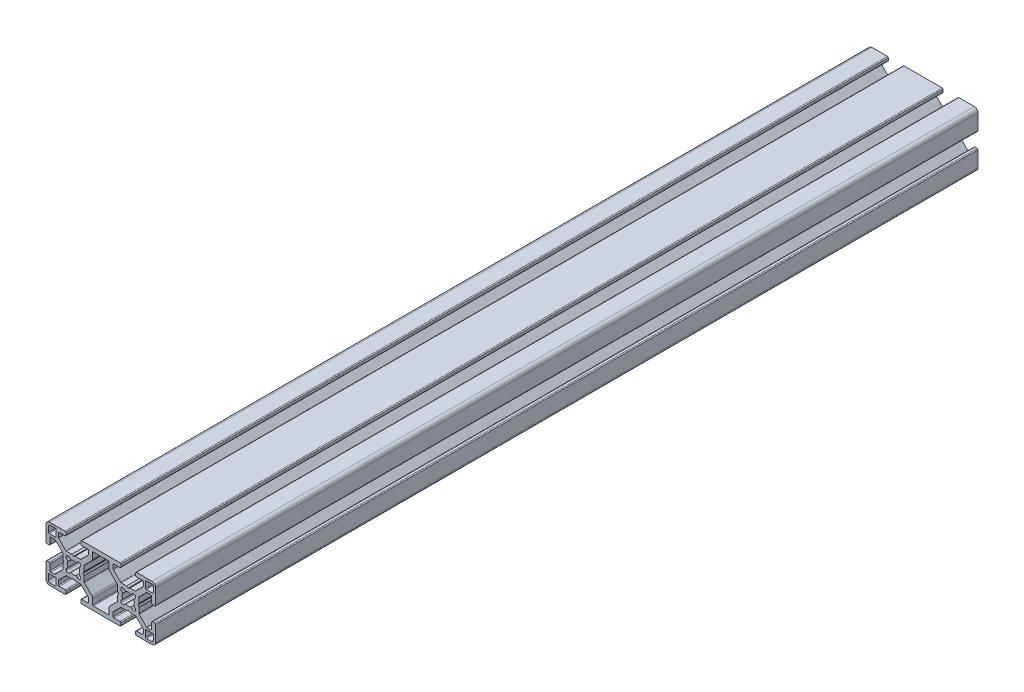
from build123d import *

# Parameters (mm, degrees)
EXTRUDE1_DEPTH = 450


with BuildPart() as part:
    # Sketch1 → Extrude1 (new body)
    with BuildSketch(Plane.XY):
        with BuildLine():
            Line((-10.428, -15), (10.428, -15))
            ThreePointArc((10.428, -15), (10.787210245, -14.851210245), (10.936, -14.492))
            Line((10.936, -14.492), (10.936, -13.2982))
            ThreePointArc((10.936, -13.2982), (10.787210245, -12.938989755), (10.428, -12.7902))
            Line((10.428, -12.7902), (7.253, -12.7902))
            ThreePointArc((7.253, -12.7902), (6.893789755, -12.641410245), (6.745, -12.2822))
            Line((6.745, -12.2822), (6.745, -10.261471714))
            ThreePointArc((6.745, -10.261471714), (6.783669197, -10.06706853), (6.893789755, -9.902261469))
            Line((6.893789755, -9.902261469), (10.825246067, -5.970805157))
            ThreePointArc((10.825246067, -5.970805157), (10.990053129, -5.860684599), (11.184456312, -5.822015402))
            Line((11.184456312, -5.822015402), (14.0475, -5.822015402))
            Line((14.0475, -5.822015402), (15, -5.314015402))
            Line((15, -5.314015402), (15.9525, -5.822015402))
            Line((15.9525, -5.822015402), (18.815543688, -5.822015402))
            ThreePointArc((18.815543688, -5.822015402), (19.009946871, -5.860684599), (19.174753933, -5.970805157))
            Line((19.174753933, -5.970805157), (23.106210245, -9.902261469))
            ThreePointArc((23.106210245, -9.902261469), (23.216330803, -10.06706853), (23.255, -10.261471714))
            Line((23.255, -10.261471714), (23.255, -12.2822))
            ThreePointArc((23.255, -12.2822), (23.106210245, -12.641410245), (22.747, -12.7902))
            Line((22.747, -12.7902), (19.572, -12.7902))
            ThreePointArc((19.572, -12.7902), (19.212789755, -12.938989755), (19.064, -13.2982))
            Line((19.064, -13.2982), (19.064, -14.492))
            ThreePointArc((19.064, -14.492), (19.212789755, -14.851210245), (19.572, -15))
            Line((19.572, -15), (27.9934, -15))
            ThreePointArc((27.9934, -15), (29.412280467, -14.412280467), (30, -12.9934))
            Line((30, -12.9934), (30, -4.572))
            ThreePointArc((30, -4.572), (29.851210245, -4.212789755), (29.492, -4.064))
            Line((29.492, -4.064), (28.2982, -4.064))
            ThreePointArc((28.2982, -4.064), (27.938989755, -4.212789755), (27.7902, -4.572))
            Line((27.7902, -4.572), (27.7902, -7.747))
            ThreePointArc((27.7902, -7.747), (27.641410245, -8.106210245), (27.2822, -8.255))
            Line((27.2822, -8.255), (25.261471714, -8.255))
            ThreePointArc((25.261471714, -8.255), (25.06706853, -8.216330803), (24.902261469, -8.106210245))
            Line((24.902261469, -8.106210245), (20.970805157, -4.174753933))
            ThreePointArc((20.970805157, -4.174753933), (20.860684599, -4.009946871), (20.822015402, -3.815543688))
            Line((20.822015402, -3.815543688), (20.822015402, -0.9525))
            Line((20.822015402, -0.9525), (20.314015402, 0))
            Line((20.314015402, 0), (20.822015402, 0.9525))
            Line((20.822015402, 0.9525), (20.822015402, 3.815543688))
            ThreePointArc((20.822015402, 3.815543688), (20.860684599, 4.009946871), (20.970805157, 4.174753933))
            Line((20.970805157, 4.174753933), (24.902261469, 8.106210245))
            ThreePointArc((24.902261469, 8.106210245), (25.06706853, 8.216330803), (25.261471714, 8.255))
            Line((25.261471714, 8.255), (27.2822, 8.255))
            ThreePointArc((27.2822, 8.255), (27.641410245, 8.106210245), (27.7902, 7.747))
            Line((27.7902, 7.747), (27.7902, 4.572))
            ThreePointArc((27.7902, 4.572), (27.938989755, 4.212789755), (28.2982, 4.064))
            Line((28.2982, 4.064), (29.492, 4.064))
            ThreePointArc((29.492, 4.064), (29.851210245, 4.212789755), (30, 4.572))
            Line((30, 4.572), (30, 12.9934))
            ThreePointArc((30, 12.9934), (29.412280467, 14.412280467), (27.9934, 15))
            Line((27.9934, 15), (19.572, 15))
            ThreePointArc((19.572, 15), (19.212789755, 14.851210245), (19.064, 14.492))
            Line((19.064, 14.492), (19.064, 13.2982))
            ThreePointArc((19.064, 13.2982), (19.212789755, 12.938989755), (19.572, 12.7902))
            Line((19.572, 12.7902), (22.747, 12.7902))
            ThreePointArc((22.747, 12.7902), (23.106210245, 12.641410245), (23.255, 12.2822))
            Line((23.255, 12.2822), (23.255, 10.261471714))
            ThreePointArc((23.255, 10.261471714), (23.216330803, 10.06706853), (23.106210245, 9.902261469))
            Line((23.106210245, 9.902261469), (19.174753933, 5.970805157))
            ThreePointArc((19.174753933, 5.970805157), (19.009946871, 5.860684599), (18.815543688, 5.822015402))
            Line((18.815543688, 5.822015402), (15.9525, 5.822015402))
            Line((15.9525, 5.822015402), (15, 5.314015402))
            Line((15, 5.314015402), (14.0475, 5.822015402))
            Line((14.0475, 5.822015402), (11.184456312, 5.822015402))
            ThreePointArc((11.184456312, 5.822015402), (10.990053129, 5.860684599), (10.825246067, 5.970805157))
            Line((10.825246067, 5.970805157), (6.893789755, 9.902261469))
            ThreePointArc((6.893789755, 9.902261469), (6.783669197, 10.06706853), (6.745, 10.261471714))
            Line((6.745, 10.261471714), (6.745, 12.2822))
            ThreePointArc((6.745, 12.2822), (6.893789755, 12.641410245), (7.253, 12.7902))
            Line((7.253, 12.7902), (10.428, 12.7902))
            ThreePointArc((10.428, 12.7902), (10.787210245, 12.938989755), (10.936, 13.2982))
            Line((10.936, 13.2982), (10.936, 14.492))
            ThreePointArc((10.936, 14.492), (10.787210245, 14.851210245), (10.428, 15))
            Line((10.428, 15), (-10.428, 15))
            ThreePointArc((-10.428, 15), (-10.787210245, 14.851210245), (-10.936, 14.492))
            Line((-10.936, 14.492), (-10.936, 13.2982))
            ThreePointArc((-10.936, 13.2982), (-10.787210245, 12.938989755), (-10.428, 12.7902))
            Line((-10.428, 12.7902), (-7.253, 12.7902))
            ThreePointArc((-7.253, 12.7902), (-6.893789755, 12.641410245), (-6.745, 12.2822))
            Line((-6.745, 12.2822), (-6.745, 10.261471714))
            ThreePointArc((-6.745, 10.261471714), (-6.783669197, 10.06706853), (-6.893789755, 9.902261469))
            Line((-6.893789755, 9.902261469), (-10.825246067, 5.970805157))
            ThreePointArc((-10.825246067, 5.970805157), (-10.990053129, 5.860684599), (-11.184456312, 5.822015402))
            Line((-11.184456312, 5.822015402), (-14.0475, 5.822015402))
            Line((-14.0475, 5.822015402), (-15, 5.314015402))
            Line((-15, 5.314015402), (-15.9525, 5.822015402))
            Line((-15.9525, 5.822015402), (-18.815543688, 5.822015402))
            ThreePointArc((-18.815543688, 5.822015402), (-19.009946871, 5.860684599), (-19.174753933, 5.970805157))
            Line((-19.174753933, 5.970805157), (-23.106210245, 9.902261469))
            ThreePointArc((-23.106210245, 9.902261469), (-23.216330803, 10.06706853), (-23.255, 10.261471714))
            Line((-23.255, 10.261471714), (-23.255, 12.2822))
            ThreePointArc((-23.255, 12.2822), (-23.106210245, 12.641410245), (-22.747, 12.7902))
            Line((-22.747, 12.7902), (-19.572, 12.7902))
            ThreePointArc((-19.572, 12.7902), (-19.212789755, 12.938989755), (-19.064, 13.2982))
            Line((-19.064, 13.2982), (-19.064, 14.492))
            ThreePointArc((-19.064, 14.492), (-19.212789755, 14.851210245), (-19.572, 15))
            Line((-19.572, 15), (-27.9934, 15))
            ThreePointArc((-27.9934, 15), (-29.412280467, 14.412280467), (-30, 12.9934))
            Line((-30, 12.9934), (-30, 4.572))
            ThreePointArc((-30, 4.572), (-29.851210245, 4.212789755), (-29.492, 4.064))
            Line((-29.492, 4.064), (-28.2982, 4.064))
            ThreePointArc((-28.2982, 4.064), (-27.938989755, 4.212789755), (-27.7902, 4.572))
            Line((-27.7902, 4.572), (-27.7902, 7.747))
            ThreePointArc((-27.7902, 7.747), (-27.641410245, 8.106210245), (-27.2822, 8.255))
            Line((-27.2822, 8.255), (-25.261471714, 8.255))
            ThreePointArc((-25.261471714, 8.255), (-25.06706853, 8.216330803), (-24.902261469, 8.106210245))
            Line((-24.902261469, 8.106210245), (-20.970805157, 4.174753933))
            ThreePointArc((-20.970805157, 4.174753933), (-20.860684599, 4.009946871), (-20.822015402, 3.815543688))
            Line((-20.822015402, 3.815543688), (-20.822015402, 0.9525))
            Line((-20.822015402, 0.9525), (-20.314015402, 0))
            Line((-20.314015402, 0), (-20.822015402, -0.9525))
            Line((-20.822015402, -0.9525), (-20.822015402, -3.815543688))
            ThreePointArc((-20.822015402, -3.815543688), (-20.860684599, -4.009946871), (-20.970805157, -4.174753933))
            Line((-20.970805157, -4.174753933), (-24.902261469, -8.106210245))
            ThreePointArc((-24.902261469, -8.106210245), (-25.06706853, -8.216330803), (-25.261471714, -8.255))
            Line((-25.261471714, -8.255), (-27.2822, -8.255))
            ThreePointArc((-27.2822, -8.255), (-27.641410245, -8.106210245), (-27.7902, -7.747))
            Line((-27.7902, -7.747), (-27.7902, -4.572))
            ThreePointArc((-27.7902, -4.572), (-27.938989755, -4.212789755), (-28.2982, -4.064))
            Line((-28.2982, -4.064), (-29.492, -4.064))
            ThreePointArc((-29.492, -4.064), (-29.851210245, -4.212789755), (-30, -4.572))
            Line((-30, -4.572), (-30, -12.9934))
            ThreePointArc((-30, -12.9934), (-29.412280467, -14.412280467), (-27.9934, -15))
            Line((-27.9934, -15), (-19.572, -15))
            ThreePointArc((-19.572, -15), (-19.212789755, -14.851210245), (-19.064, -14.492))
            Line((-19.064, -14.492), (-19.064, -13.2982))
            ThreePointArc((-19.064, -13.2982), (-19.212789755, -12.938989755), (-19.572, -12.7902))
            Line((-19.572, -12.7902), (-22.747, -12.7902))
            ThreePointArc((-22.747, -12.7902), (-23.106210245, -12.641410245), (-23.255, -12.2822))
            Line((-23.255, -12.2822), (-23.255, -10.261471714))
            ThreePointArc((-23.255, -10.261471714), (-23.216330803, -10.06706853), (-23.106210245, -9.902261469))
            Line((-23.106210245, -9.902261469), (-19.174753933, -5.970805157))
            ThreePointArc((-19.174753933, -5.970805157), (-19.009946871, -5.860684599), (-18.815543688, -5.822015402))
            Line((-18.815543688, -5.822015402), (-15.9525, -5.822015402))
            Line((-15.9525, -5.822015402), (-15, -5.314015402))
            Line((-15, -5.314015402), (-14.0475, -5.822015402))
            Line((-14.0475, -5.822015402), (-11.184456312, -5.822015402))
            ThreePointArc((-11.184456312, -5.822015402), (-10.990053129, -5.860684599), (-10.825246067, -5.970805157))
            Line((-10.825246067, -5.970805157), (-6.893789755, -9.902261469))
            ThreePointArc((-6.893789755, -9.902261469), (-6.783669197, -10.06706853), (-6.745, -10.261471714))
            Line((-6.745, -10.261471714), (-6.745, -12.2822))
            ThreePointArc((-6.745, -12.2822), (-6.893789755, -12.641410245), (-7.253, -12.7902))
            Line((-7.253, -12.7902), (-10.428, -12.7902))
            ThreePointArc((-10.428, -12.7902), (-10.787210245, -12.938989755), (-10.936, -13.2982))
            Line((-10.936, -13.2982), (-10.936, -14.492))
            ThreePointArc((-10.936, -14.492), (-10.787210245, -14.851210245), (-10.428, -15))
        make_face()
        with BuildLine():
            Line((12.782541514, 3.726141514), (13.525717665, 2.982965363))
            ThreePointArc((13.525717665, 2.982965363), (15, 3.3274), (16.474282335, 2.982965363))
            Line((16.474282335, 2.982965363), (17.217458486, 3.726141514))
            ThreePointArc((17.217458486, 3.726141514), (18.726141514, 3.726141514), (18.726141514, 2.217458486))
            Line((18.726141514, 2.217458486), (17.982965363, 1.474282335))
            ThreePointArc((17.982965363, 1.474282335), (18.3274, 0), (17.982965363, -1.474282335))
            Line((17.982965363, -1.474282335), (18.726141514, -2.217458486))
            ThreePointArc((18.726141514, -2.217458486), (18.726141514, -3.726141514), (17.217458486, -3.726141514))
            Line((17.217458486, -3.726141514), (16.474282335, -2.982965363))
            ThreePointArc((16.474282335, -2.982965363), (15, -3.3274), (13.525717665, -2.982965363))
            Line((13.525717665, -2.982965363), (12.782541514, -3.726141514))
            ThreePointArc((12.782541514, -3.726141514), (11.273858486, -3.726141514), (11.273858486, -2.217458486))
            Line((11.273858486, -2.217458486), (12.017034637, -1.474282335))
            ThreePointArc((12.017034637, -1.474282335), (11.6726, 0), (12.017034637, 1.474282335))
            Line((12.017034637, 1.474282335), (11.273858486, 2.217458486))
            ThreePointArc((11.273858486, 2.217458486), (11.273858486, 3.726141514), (12.782541514, 3.726141514))
        make_face(mode=Mode.SUBTRACT)
        with BuildLine():
            Line((-28.7046, 9.8946), (-28.7046, 12.6886))
            ThreePointArc((-28.7046, 12.6886), (-28.40702049, 13.40702049), (-27.6886, 13.7046))
            Line((-27.6886, 13.7046), (-24.8946, 13.7046))
            ThreePointArc((-24.8946, 13.7046), (-24.625192316, 13.593007684), (-24.5136, 13.3236))
            Line((-24.5136, 13.3236), (-24.5136, 9.8946))
            ThreePointArc((-24.5136, 9.8946), (-24.625192316, 9.625192316), (-24.8946, 9.5136))
            Line((-24.8946, 9.5136), (-28.3236, 9.5136))
            ThreePointArc((-28.3236, 9.5136), (-28.593007684, 9.625192316), (-28.7046, 9.8946))
        make_face(mode=Mode.SUBTRACT)
        with BuildLine():
            Line((-24.8946, -13.7046), (-27.6886, -13.7046))
            ThreePointArc((-27.6886, -13.7046), (-28.40702049, -13.40702049), (-28.7046, -12.6886))
            Line((-28.7046, -12.6886), (-28.7046, -9.8946))
            ThreePointArc((-28.7046, -9.8946), (-28.593007684, -9.625192316), (-28.3236, -9.5136))
            Line((-28.3236, -9.5136), (-24.8946, -9.5136))
            ThreePointArc((-24.8946, -9.5136), (-24.625192316, -9.625192316), (-24.5136, -9.8946))
            Line((-24.5136, -9.8946), (-24.5136, -13.3236))
            ThreePointArc((-24.5136, -13.3236), (-24.625192316, -13.593007684), (-24.8946, -13.7046))
        make_face(mode=Mode.SUBTRACT)
        with BuildLine():
            Line((4.981569265, 8.22237951), (9.029194843, 4.174753933))
            ThreePointArc((9.029194843, 4.174753933), (9.139315401, 4.009946871), (9.177984598, 3.815543688))
            Line((9.177984598, 3.815543688), (9.177984598, 0.9525))
            Line((9.177984598, 0.9525), (9.685984598, 0))
            Line((9.685984598, 0), (9.177984598, -0.9525))
            Line((9.177984598, -0.9525), (9.177984598, -3.815543688))
            ThreePointArc((9.177984598, -3.815543688), (9.139315401, -4.009946871), (9.029194843, -4.174753933))
            Line((9.029194843, -4.174753933), (4.981569265, -8.22237951))
            ThreePointArc((4.981569265, -8.22237951), (4.651207592, -8.716800694), (4.5352, -9.300010245))
            Line((4.5352, -9.300010245), (4.5352, -12.4092))
            ThreePointArc((4.5352, -12.4092), (4.423607684, -12.678607684), (4.1542, -12.7902))
            Line((4.1542, -12.7902), (-4.1542, -12.7902))
            ThreePointArc((-4.1542, -12.7902), (-4.423607684, -12.678607684), (-4.5352, -12.4092))
            Line((-4.5352, -12.4092), (-4.5352, -9.300010245))
            ThreePointArc((-4.5352, -9.300010245), (-4.651207592, -8.716800694), (-4.981569265, -8.22237951))
            Line((-4.981569265, -8.22237951), (-9.029194843, -4.174753933))
            ThreePointArc((-9.029194843, -4.174753933), (-9.139315401, -4.009946871), (-9.177984598, -3.815543688))
            Line((-9.177984598, -3.815543688), (-9.177984598, -0.9525))
            Line((-9.177984598, -0.9525), (-9.685984598, 0))
            Line((-9.685984598, 0), (-9.177984598, 0.9525))
            Line((-9.177984598, 0.9525), (-9.177984598, 3.815543688))
            ThreePointArc((-9.177984598, 3.815543688), (-9.139315401, 4.009946871), (-9.029194843, 4.174753933))
            Line((-9.029194843, 4.174753933), (-4.981569265, 8.22237951))
            ThreePointArc((-4.981569265, 8.22237951), (-4.651207592, 8.716800694), (-4.5352, 9.300010245))
            Line((-4.5352, 9.300010245), (-4.5352, 12.4092))
            ThreePointArc((-4.5352, 12.4092), (-4.423607684, 12.678607684), (-4.1542, 12.7902))
            Line((-4.1542, 12.7902), (4.1542, 12.7902))
            ThreePointArc((4.1542, 12.7902), (4.423607684, 12.678607684), (4.5352, 12.4092))
            Line((4.5352, 12.4092), (4.5352, 9.300010245))
            ThreePointArc((4.5352, 9.300010245), (4.651207592, 8.716800694), (4.981569265, 8.22237951))
        make_face(mode=Mode.SUBTRACT)
        with BuildLine():
            Line((-18.726141514, -2.217458486), (-17.982965363, -1.474282335))
            ThreePointArc((-17.982965363, -1.474282335), (-18.3274, 0), (-17.982965363, 1.474282335))
            Line((-17.982965363, 1.474282335), (-18.726141514, 2.217458486))
            ThreePointArc((-18.726141514, 2.217458486), (-18.726141514, 3.726141514), (-17.217458486, 3.726141514))
            Line((-17.217458486, 3.726141514), (-16.474282335, 2.982965363))
            ThreePointArc((-16.474282335, 2.982965363), (-15, 3.3274), (-13.525717665, 2.982965363))
            Line((-13.525717665, 2.982965363), (-12.782541514, 3.726141514))
            ThreePointArc((-12.782541514, 3.726141514), (-11.273858486, 3.726141514), (-11.273858486, 2.217458486))
            Line((-11.273858486, 2.217458486), (-12.017034637, 1.474282335))
            ThreePointArc((-12.017034637, 1.474282335), (-11.6726, 0), (-12.017034637, -1.474282335))
            Line((-12.017034637, -1.474282335), (-11.273858486, -2.217458486))
            ThreePointArc((-11.273858486, -2.217458486), (-11.273858486, -3.726141514), (-12.782541514, -3.726141514))
            Line((-12.782541514, -3.726141514), (-13.525717665, -2.982965363))
            ThreePointArc((-13.525717665, -2.982965363), (-15, -3.3274), (-16.474282335, -2.982965363))
            Line((-16.474282335, -2.982965363), (-17.217458486, -3.726141514))
            ThreePointArc((-17.217458486, -3.726141514), (-18.726141514, -3.726141514), (-18.726141514, -2.217458486))
        make_face(mode=Mode.SUBTRACT)
        with BuildLine():
            Line((24.8946, 13.7046), (27.6886, 13.7046))
            ThreePointArc((27.6886, 13.7046), (28.40702049, 13.40702049), (28.7046, 12.6886))
            Line((28.7046, 12.6886), (28.7046, 9.8946))
            ThreePointArc((28.7046, 9.8946), (28.593007684, 9.625192316), (28.3236, 9.5136))
            Line((28.3236, 9.5136), (24.8946, 9.5136))
            ThreePointArc((24.8946, 9.5136), (24.625192316, 9.625192316), (24.5136, 9.8946))
            Line((24.5136, 9.8946), (24.5136, 13.3236))
            ThreePointArc((24.5136, 13.3236), (24.625192316, 13.593007684), (24.8946, 13.7046))
        make_face(mode=Mode.SUBTRACT)
        with BuildLine():
            Line((24.5136, -13.3236), (24.5136, -9.8946))
            ThreePointArc((24.5136, -9.8946), (24.625192316, -9.625192316), (24.8946, -9.5136))
            Line((24.8946, -9.5136), (28.3236, -9.5136))
            ThreePointArc((28.3236, -9.5136), (28.593007684, -9.625192316), (28.7046, -9.8946))
            Line((28.7046, -9.8946), (28.7046, -12.6886))
            ThreePointArc((28.7046, -12.6886), (28.40702049, -13.40702049), (27.6886, -13.7046))
            Line((27.6886, -13.7046), (24.8946, -13.7046))
            ThreePointArc((24.8946, -13.7046), (24.625192316, -13.593007684), (24.5136, -13.3236))
        make_face(mode=Mode.SUBTRACT)
    extrude(amount=-EXTRUDE1_DEPTH)


solid = part.part
